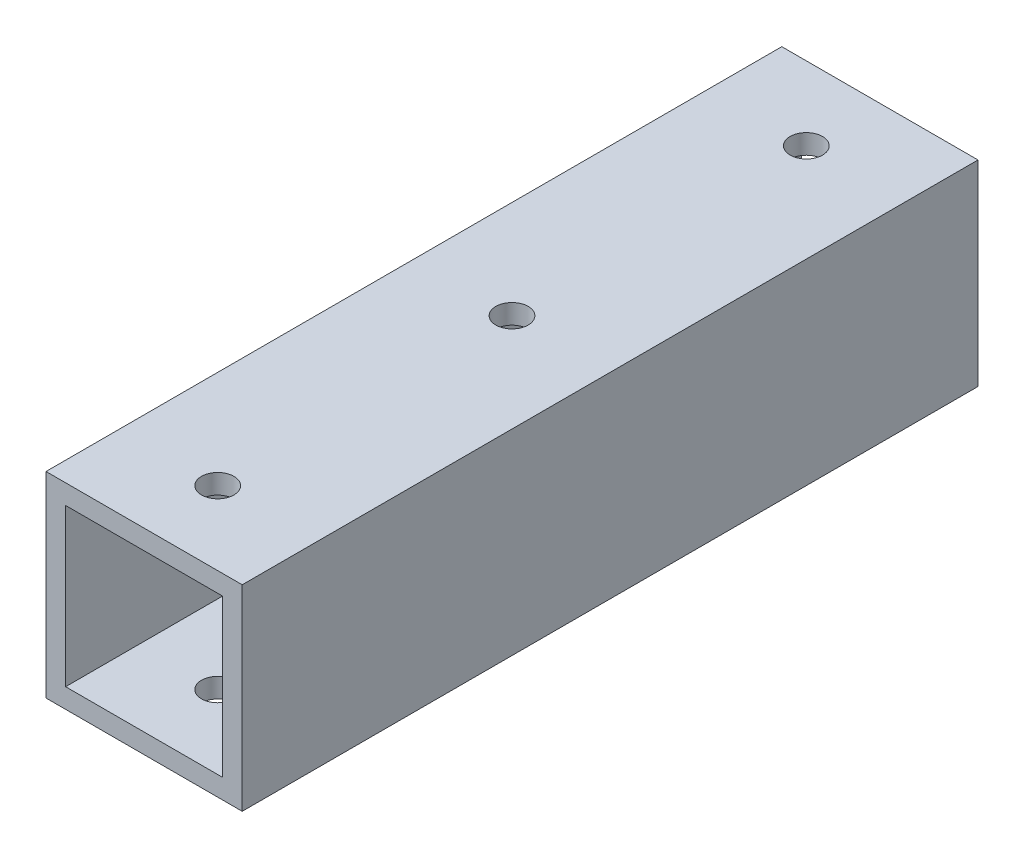
from build123d import *

# Parameters (mm, degrees)
SKETCH_1_W          = 20
SKETCH_1_H          = 20
SKETCH_1_W_2        = 16
SKETCH_1_H_2        = 16
EXTRUDE_1_DEPTH     = 75
SKETCH_2_R          = 1.65
CUT_EXTRUDE_1_DEPTH = 70


with BuildPart() as part:
    # 草图1 → 凸台-拉伸1 (new body)
    with BuildSketch(Plane.XY):
        Rectangle(SKETCH_1_W, SKETCH_1_H)
        Rectangle(SKETCH_1_W_2, SKETCH_1_H_2, mode=Mode.SUBTRACT)
    extrude(amount=EXTRUDE_1_DEPTH)

    # 草图2 → 切除-拉伸1 (cut)
    with BuildSketch(Plane(origin=(0, 10, 0), x_dir=(1, 0, 0), z_dir=(0, 1, 0))):
        with Locations(Location((0, -37.5, 0), (0, 0, 270))):
            Circle(SKETCH_2_R)
        with Locations(Location((0, -7.5, 0), (0, 0, 270))):
            Circle(SKETCH_2_R)
        with Locations(Location((0, -67.5, 0), (0, 0, 270))):
            Circle(SKETCH_2_R)
    extrude(amount=-CUT_EXTRUDE_1_DEPTH, mode=Mode.SUBTRACT)


solid = part.part
